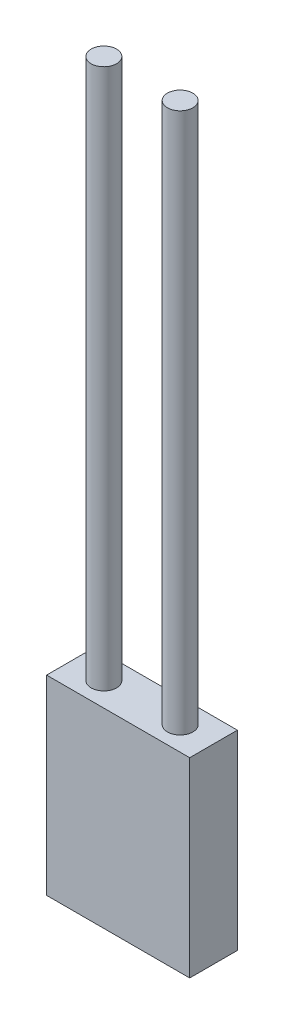
from build123d import *

# Parameters (mm, degrees)
CROQUIS1_W              = 45
CROQUIS1_H              = 60
SALIENTE_EXTRUIR1_DEPTH = 7.5
CROQUIS2_W              = 4
CROQUIS2_H              = 170


with BuildPart() as part:
    # Croquis1 → Saliente-Extruir1 (new, symmetric)
    with BuildSketch(Plane.XY):
        Rectangle(CROQUIS1_W, CROQUIS1_H)
    extrude(amount=SALIENTE_EXTRUIR1_DEPTH, both=True)

    # Croquis2 → Revolución1 (revolve)
    with BuildSketch(Plane.XY, mode=Mode.PRIVATE) as revoluci_n1_sk:
        with Locations((-14, 115)):
            Rectangle(CROQUIS2_W, CROQUIS2_H)
    revoluci_n1 = revolve(revoluci_n1_sk.sketch.rotate(Axis((-12, 30, 0), (0, 1, 0)), 270), axis=Axis((-12, 30, 0), (0, 1, 0)))

    # Simetría1: Revolución1 across plane
    add(revoluci_n1.mirror(Plane(origin=(0, 0, 0), x_dir=(0, 0, 1), z_dir=(1, 0, 0))))


solid = part.part
